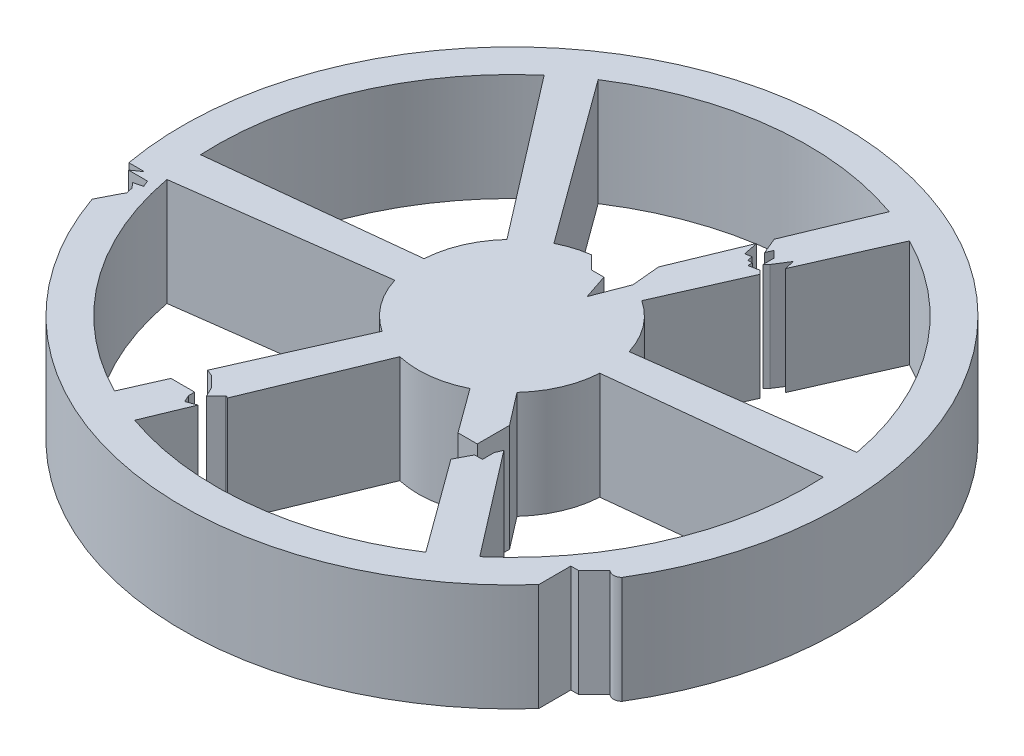
from build123d import *

# Parameters (mm, degrees)
SKETCH1_R           = 69.948062861
BOSS_EXTRUDE1_DEPTH = 25.4
BOSS_EXTRUDE2_DEPTH = 25.4


with BuildPart() as part:
    # Sketch1 → Boss-Extrude1 (new body)
    with BuildSketch(Plane(origin=(0, 0, 0), x_dir=(1, 0, 0), z_dir=(0, 1, 0))):
        with BuildLine():
            ThreePointArc((63.74187476, -40.530752622), (65.16096079, -41.118557302), (66.58004682, -40.530752622))
            ThreePointArc((66.58004682, -40.530752622), (14.23733744, 76.635127489), (-76.694663108, -13.913058378))
            Line((-76.694663108, -13.913058378), (-73.000086536, -13.913058378))
            Line((-73.000086536, -13.913058378), (-75.252390768, -15.474368763))
            Line((-75.252390768, -15.474368763), (-70.740426062, -15.474368763))
            Line((-70.740426062, -15.474368763), (-70.080138544, -17.015039639))
            Line((-70.080138544, -17.015039639), (-72.166015782, -17.521478191))
            Line((-72.166015782, -17.521478191), (-71.123077163, -18.775806353))
            Line((-71.123077163, -18.775806353), (-70.740426062, -20.351838073))
            Line((-70.740426062, -20.351838073), (-71.268418719, -21.218426764))
            Line((-71.268418719, -21.218426764), (-72.996408415, -24.608346096))
            Line((-72.996408415, -24.608346096), (-73.573552306, -25.740569997))
            ThreePointArc((-73.573552306, -25.740569997), (-15.15436006, -76.459073457), (58.193519931, -51.857099617))
            Line((58.193519931, -51.857099617), (58.193519931, -44.265552602))
            Line((58.193519931, -44.265552602), (60.00707478, -44.265552602))
            Line((60.00707478, -44.265552602), (63.74187476, -40.530752622))
        make_face()
        with Locations(Location((0, 0, 0), (0, 0, 90))):
            Circle(SKETCH1_R, mode=Mode.SUBTRACT)
    extrude(amount=BOSS_EXTRUDE1_DEPTH)

    # Sketch2 → Boss-Extrude2 (add)
    with BuildSketch(Plane.XZ):
        with BuildLine():
            Line((16.91938422, -42.867763876), (15.301396265, -46.734397981))
            Line((15.301396265, -46.734397981), (23.266647688, -65.965101405))
            ThreePointArc((23.266647688, -65.965101405), (27.508582432, -64.311813771), (31.633980927, -62.386078164))
            Line((31.633980927, -62.386078164), (22.646440609, -42.05853708))
            Line((22.646440609, -42.05853708), (22.122487474, -44.43690451))
            Line((22.122487474, -44.43690451), (19.98105683, -41.085378254))
            Line((19.98105683, -41.085378254), (19.154678805, -40.246982073))
            Line((19.154678805, -40.246982073), (19.154678805, -42.867763876))
            Line((19.154678805, -42.867763876), (17.562717892, -44.43690451))
            Line((17.562717892, -44.43690451), (16.91938422, -42.867763876))
        make_face()
        with BuildLine():
            Line((7.295677294, -27.358886688), (14.085059503, -43.790609078))
            Line((14.085059503, -43.790609078), (14.802816622, -40.246982073))
            Line((14.802816622, -40.246982073), (16.254758128, -40.541070969))
            Line((16.254758128, -40.541070969), (16.507439862, -39.293560089))
            Line((16.507439862, -39.293560089), (17.562717892, -39.293560089))
            Line((17.562717892, -39.293560089), (17.562717892, -38.21621684))
            Line((17.562717892, -38.21621684), (19.98105683, -38.7060483))
            Line((19.98105683, -38.7060483), (20.801456059, -37.88564907))
            Line((20.801456059, -37.88564907), (12.224600097, -18.486972039))
            ThreePointArc((12.224600097, -18.486972039), (17.735408563, -13.291511043), (21.175132345, -6.543909602))
            Line((21.175132345, -6.543909602), (68.757486976, -12.850660789))
            ThreePointArc((68.757486976, -12.850660789), (69.448887589, -8.341673136), (69.844918996, -3.797207976))
            Line((69.844918996, -3.797207976), (22.122487474, 1.343328216))
            ThreePointArc((22.122487474, 1.343328216), (20.3784905, 8.713558841), (16.254758128, 15.066247738))
            Line((16.254758128, 15.066247738), (22.122487474, 22.699365292))
            Line((22.122487474, 22.699365292), (22.122487474, 30.322912753))
            Line((22.122487474, 30.322912753), (17.562717892, 30.322912753))
            Line((17.562717892, 30.322912753), (9.897887376, 19.830300255))
            ThreePointArc((9.897887376, 19.830300255), (2.643081937, 22.005069884), (-4.920374217, 21.610157341))
            Line((-4.920374217, 21.610157341), (-16.826086698, 50.424467144))
            Line((-16.826086698, 50.424467144), (-17.435403285, 50.17270515))
            Line((-17.435403285, 50.17270515), (-19.742011126, 52.479312991))
            Line((-19.742011126, 52.479312991), (-20.850502701, 50.169534038))
            Line((-20.850502701, 50.169534038), (-23.249744789, 47.77029195))
            Line((-23.249744789, 47.77029195), (-24.874918704, 47.098790412))
            Line((-24.874918704, 47.098790412), (-12.224600097, 18.486972039))
            ThreePointArc((-12.224600097, 18.486972039), (-17.735408563, 13.291511043), (-21.175132345, 6.543909602))
            Line((-21.175132345, 6.543909602), (-68.757486976, 12.850660789))
            ThreePointArc((-68.757486976, 12.850660789), (-69.448887589, 8.341673136), (-69.844918996, 3.797207976))
            Line((-69.844918996, 3.797207976), (-22.122487474, -1.343328216))
            ThreePointArc((-22.122487474, -1.343328216), (-20.3784905, -8.713558841), (-16.254758128, -15.066247738))
            Line((-16.254758128, -15.066247738), (-45.507742187, -53.120400027))
            ThreePointArc((-45.507742187, -53.120400027), (-41.94854464, -55.973664348), (-38.210938069, -58.588870188))
            Line((-38.210938069, -58.588870188), (-9.897887376, -19.830300255))
            ThreePointArc((-9.897887376, -19.830300255), (-6.593278337, -21.159812463), (-3.118363368, -21.942761737))
            Line((-3.118363368, -21.942761737), (0, -18.824398369))
            Line((0, -18.824398369), (2.927922909, -18.824398369))
            Line((2.927922909, -18.824398369), (4.920374217, -12.850660789))
            Line((4.920374217, -12.850660789), (7.924997395, -20.697908083))
            Line((7.924997395, -20.697908083), (7.295677294, -27.358886688))
        make_face()
        with BuildLine():
            ThreePointArc((-23.249744789, 65.971060816), (-27.500342949, 64.315337484), (-31.633980927, 62.386078164))
            Line((-31.633980927, 62.386078164), (-27.537289867, 53.120400027))
            Line((-27.537289867, 53.120400027), (-21.929290512, 53.120400027))
            Line((-21.929290512, 53.120400027), (-21.929290512, 54.528885617))
            Line((-21.929290512, 54.528885617), (-21.175132345, 56.232852652))
            Line((-21.175132345, 56.232852652), (-18.874010019, 55.380869134))
            Line((-18.874010019, 55.380869134), (-23.249744789, 65.971060816))
        make_face()
        with BuildLine():
            Line((26.56555805, 28.479195616), (45.507742187, 53.120400027))
            ThreePointArc((45.507742187, 53.120400027), (41.94854464, 55.973664348), (38.210938069, 58.588870188))
            Line((38.210938069, 58.588870188), (22.122487474, 36.564915784))
            Line((22.122487474, 36.564915784), (24.054412722, 32.87896942))
            Line((24.054412722, 32.87896942), (25.891298269, 32.87896942))
            Line((25.891298269, 32.87896942), (25.891298269, 30.109133149))
            Line((25.891298269, 30.109133149), (26.56555805, 28.479195616))
        make_face()
    extrude(amount=-BOSS_EXTRUDE2_DEPTH)


solid = part.part
